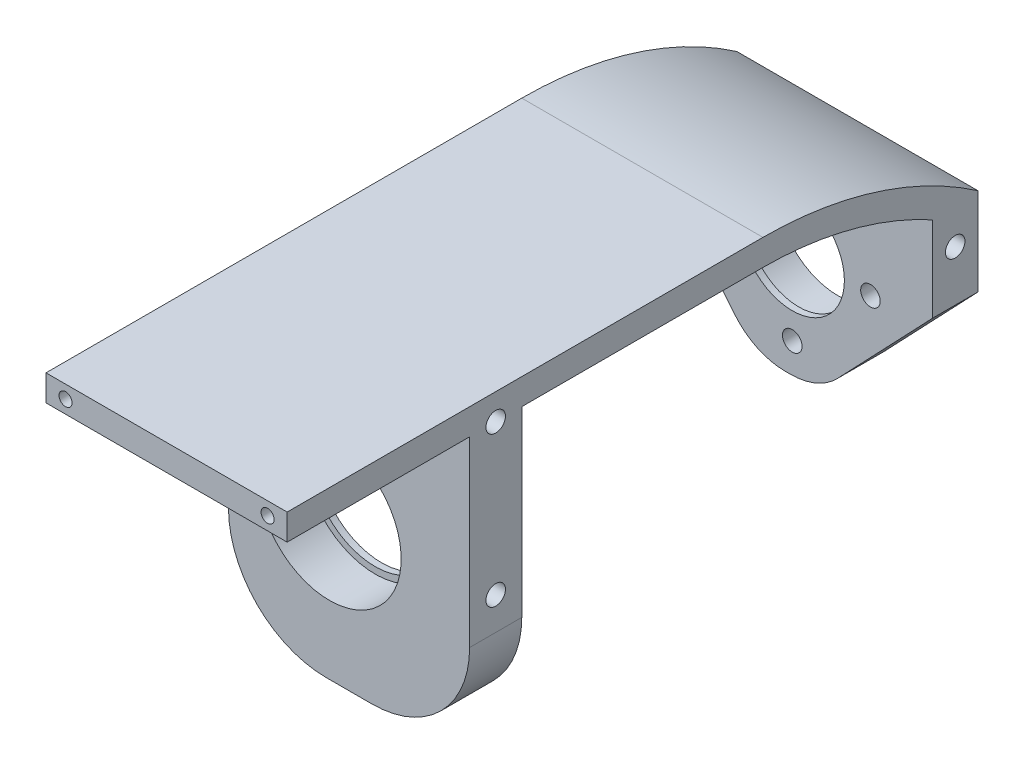
from build123d import *

# Parameters (mm, degrees)
BOSS_EXTRUDE1_DEPTH = 37
BOSS_EXTRUDE3_DEPTH = 37
SKETCH5_R           = 11
CUT_EXTRUDE1_DEPTH  = 7
SKETCH6_R           = 10
CUT_EXTRUDE2_DEPTH  = 7
BOSS_EXTRUDE4_START = -37
BOSS_EXTRUDE4_DEPTH = 37
SKETCH8_R           = 9.5
CUT_EXTRUDE3_DEPTH  = 6
SKETCH9_R           = 8
CUT_EXTRUDE4_DEPTH  = 1
CUT_EXTRUDE5_DEPTH  = 7
CUT_EXTRUDE6_DEPTH  = 131.044047905
FILLET2_R           = 10
SKETCH12_R          = 1.5
CUT_EXTRUDE7_DEPTH  = 116.667627277
FILLET5_R           = 15
SKETCH20_R          = 1.5
CUT_EXTRUDE14_DEPTH = 6
SKETCH21_R          = 1
CUT_EXTRUDE15_DEPTH = 6


with BuildPart() as part:
    # Sketch3 → Boss-Extrude1 (new body)
    with BuildSketch(Plane(origin=(0, 0, 0), x_dir=(0, 0, -1), z_dir=(1, 0, 0))):
        with BuildLine():
            Line((0, 0), (73, 0))
            ThreePointArc((73, 0), (96.162469644, -4.825758115), (115.470578051, -18.5))
            Line((115.470578051, -18.5), (109.820510589, -18.5))
            ThreePointArc((109.820510589, -18.5), (107.466378544, -16.429953692), (104.996093512, -14.5))
            ThreePointArc((104.996093512, -14.5), (89.83745824, -6.692105871), (73, -4))
            Line((73, -4), (0, -4))
            Line((0, -4), (0, 0))
        make_face()
    extrude(amount=BOSS_EXTRUDE1_DEPTH)

    # Sketch4 → Boss-Extrude3 (add)
    with BuildSketch(Plane(origin=(37, 0, 0), x_dir=(0, 0, -1), z_dir=(1, 0, 0))):
        Polygon((28, -4), (28, -14.5), (28, -36.5), (28, -47), (36, -47), (36, -35.5), (36, -15.5), (36, -4), align=None)
    extrude(amount=-BOSS_EXTRUDE3_DEPTH)

    # Sketch5 → Cut-Extrude1 (cut)
    with BuildSketch(Plane.XY.offset(-28)):
        with Locations((21.5, -25.5)):
            Circle(SKETCH5_R)
    extrude(amount=-CUT_EXTRUDE1_DEPTH, mode=Mode.SUBTRACT)

    # Sketch6 → Cut-Extrude2 (cut)
    with BuildSketch(Plane.XY.offset(-35)):
        with Locations((21.5, -25.5)):
            Circle(SKETCH6_R)
    extrude(amount=-CUT_EXTRUDE2_DEPTH, mode=Mode.SUBTRACT)

    # Sketch7 → Boss-Extrude4 (add)
    with BuildSketch(Plane(origin=(37, 0, 0), x_dir=(0, 0, -1), z_dir=(1, 0, 0)).offset(BOSS_EXTRUDE4_START)):
        with BuildLine():
            Line((99, -10.671361735), (99, -47))
            Line((99, -47), (106, -47))
            Line((106, -47), (106, -15.256579454))
            ThreePointArc((106, -15.256579454), (102.588951576, -12.82817311), (99, -10.671361735))
        make_face()
    extrude(amount=BOSS_EXTRUDE4_DEPTH)

    # Sketch8 → Cut-Extrude3 (cut)
    with BuildSketch(Plane.XY.offset(-106)):
        with Locations((21.5, -25.5)):
            Circle(SKETCH8_R)
    extrude(amount=CUT_EXTRUDE3_DEPTH, mode=Mode.SUBTRACT)

    # Sketch9 → Cut-Extrude4 (cut)
    with BuildSketch(Plane(origin=(0, 0, -100), x_dir=(-1, 0, 0), z_dir=(0, 0, -1))):
        with Locations((-21.5, -25.5)):
            Circle(SKETCH9_R)
    extrude(amount=-CUT_EXTRUDE4_DEPTH, mode=Mode.SUBTRACT)

    # Sketch10 → Cut-Extrude5 (cut)
    with BuildSketch(Plane(origin=(0, 0, -106), x_dir=(-1, 0, 0), z_dir=(0, 0, -1))):
        Polygon((0, -23.757683827), (-17.471056315, -42.081867062), (-27.318513182, -42.081867062), (-37, -30.228411032), (-37, -47), (0, -47), align=None)
    extrude(amount=-CUT_EXTRUDE5_DEPTH, mode=Mode.SUBTRACT)

    # Sketch11 → Cut-Extrude6 (cut, through all)
    with BuildSketch(Plane(origin=(37, 0, 0), x_dir=(0, 0, -1), z_dir=(1, 0, 0))):
        with BuildLine():
            Line((106, -15.256579454), (106, -10.303039929))
            ThreePointArc((106, -10.303039929), (110.957207174, -14.145120869), (115.470578051, -18.5))
            Line((115.470578051, -18.5), (109.820510589, -18.5))
            ThreePointArc((109.820510589, -18.5), (107.947902211, -16.833944431), (106, -15.256579454))
        make_face()
    extrude(amount=-CUT_EXTRUDE6_DEPTH, mode=Mode.SUBTRACT)

    # Fillet2
    fillet2_edges = [part.edges().sort_by_distance(p)[0] for p in [
        (17.471056315, -42.081867062, -102.5),
        (27.318513182, -42.081867062, -102.5),
    ]]
    fillet(fillet2_edges, radius=FILLET2_R)

    # Sketch12 → Cut-Extrude7 (cut, through all)
    with BuildSketch(Plane.XY.offset(-99)):
        with Locations((21.5, -13.5)):
            Circle(SKETCH12_R)
        with Locations((33.5, -25.5)):
            Circle(SKETCH12_R)
        with Locations((21.5, -37.5)):
            Circle(SKETCH12_R)
        with Locations((9.5, -25.5)):
            Circle(SKETCH12_R)
    extrude(amount=-CUT_EXTRUDE7_DEPTH, mode=Mode.SUBTRACT)

    # Fillet5
    fillet5_edges = [part.edges().sort_by_distance(p)[0] for p in [
        (0, -47, -32),
        (37, -47, -32),
    ]]
    fillet(fillet5_edges, radius=FILLET5_R)

    # Sketch20 → Cut-Extrude14 (cut)
    with BuildSketch(Plane.ZY):
        with Locations((-32, -4)):
            Circle(SKETCH20_R)
        with Locations((-102.5, -16)):
            Circle(SKETCH20_R)
        with Locations((-32, -27)):
            Circle(SKETCH20_R)
    extrude(amount=-CUT_EXTRUDE14_DEPTH, mode=Mode.SUBTRACT)

    # Sketch21 → Cut-Extrude15 (cut)
    with BuildSketch(Plane.XY):
        with Locations((3, -2)):
            Circle(SKETCH21_R)
        with Locations((34, -2)):
            Circle(SKETCH21_R)
    extrude(amount=-CUT_EXTRUDE15_DEPTH, mode=Mode.SUBTRACT)


with BuildPart() as body_2:
    # Mirror1: mirrored copy
    add(part.part.mirror(Plane(origin=(37, -58, -73), x_dir=(0, 0, 1), z_dir=(-1, 0, 0))))


solid = body_2.part
